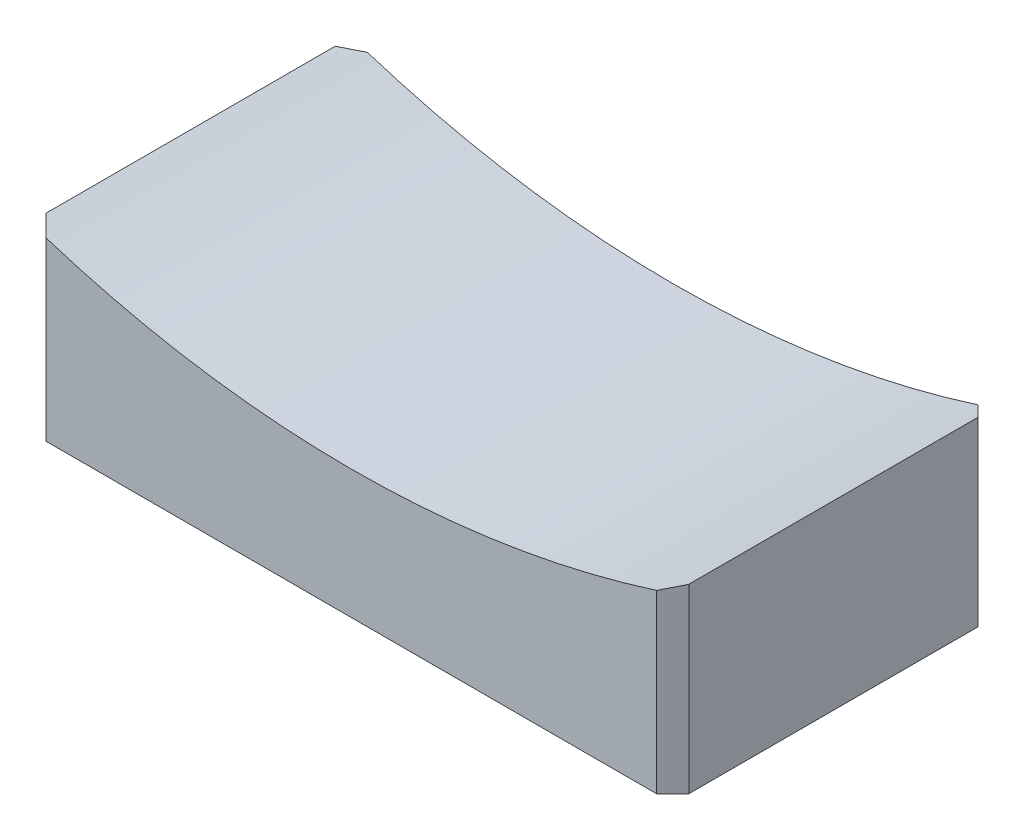
from build123d import *

# Parameters (mm, degrees)
BOSS_EXTRUDE1_DEPTH = 12.7
CHAMFER1_SIZE       = 0.635


with BuildPart() as part:
    # Sketch1 → Boss-Extrude1 (new body)
    with BuildSketch(Plane.XY):
        with BuildLine():
            Line((-12.7, 7.170396709), (-12.7, 0))
            Line((-12.7, 0), (12.7, 0))
            Line((12.7, 0), (12.7, 7.170396709))
            ThreePointArc((12.7, 7.170396709), (0, 5.08), (-12.7, 7.170396709))
        make_face()
    extrude(amount=BOSS_EXTRUDE1_DEPTH)

    # Chamfer1
    chamfer1_edges = [part.edges().sort_by_distance(p)[0] for p in [
        (12.7, 3.585198355, 12.7),
        (12.7, 3.585198355, 0),
        (-12.7, 3.585198355, 0),
        (-12.7, 3.585198355, 12.7),
    ]]
    chamfer(chamfer1_edges, length=CHAMFER1_SIZE)


solid = part.part
